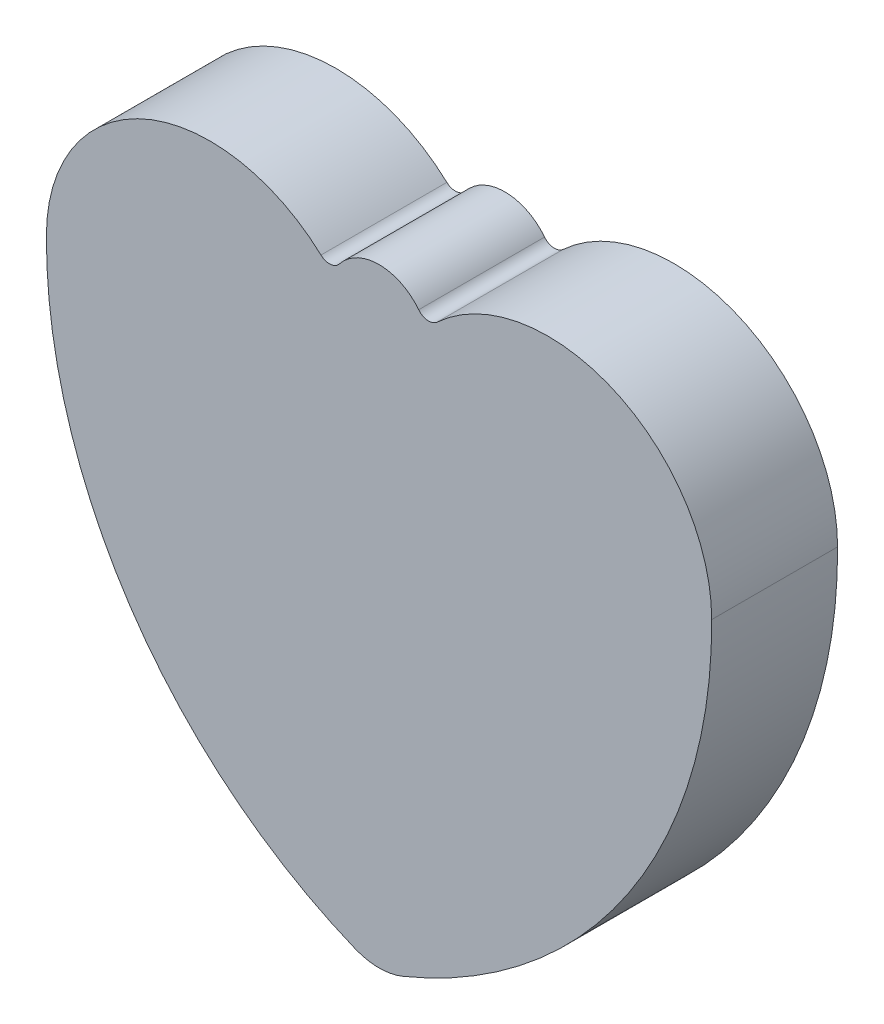
from build123d import *

# Parameters (mm, degrees)
DODANIE_WYCI_GNI_CIE1_DEPTH = 10
SKALA1_SCALE                = 0.9


with BuildPart() as part:
    # Szkic1 → Dodanie-wyciągnięcie1 (new body)
    with BuildSketch(Plane.XY):
        with BuildLine():
            ThreePointArc((-4.61531313, 22.743178996), (-18.644238864, 25.090860352), (-26.425868288, 13.184197993))
            ThreePointArc((-26.425868288, 13.184197993), (-19.794080105, -8.974802604), (-1.896314698, -23.62648904))
            ThreePointArc((-1.896314698, -23.62648904), (0, -24.000044339), (1.896314698, -23.62648904))
            ThreePointArc((1.896314698, -23.62648904), (19.794080105, -8.974802604), (26.425868288, 13.184197993))
            ThreePointArc((26.425868288, 13.184197993), (18.644238864, 25.090860352), (4.61531313, 22.743178996))
            ThreePointArc((4.61531313, 22.743178996), (3.856622065, 22.481767555), (3.150062494, 22.862190539))
            ThreePointArc((3.150062494, 22.862190539), (0, 24.397011786), (-3.150062494, 22.862190539))
            ThreePointArc((-3.150062494, 22.862190539), (-3.856622065, 22.481767555), (-4.61531313, 22.743178996))
        make_face()
    extrude(amount=DODANIE_WYCI_GNI_CIE1_DEPTH)


with BuildPart() as part_1:
    # Skala1: scaled about (0, 3.998335482, 5)
    add(part.part.scale(SKALA1_SCALE).moved(Location((0, 0.399833548, 0.5))))


solid = part_1.part
